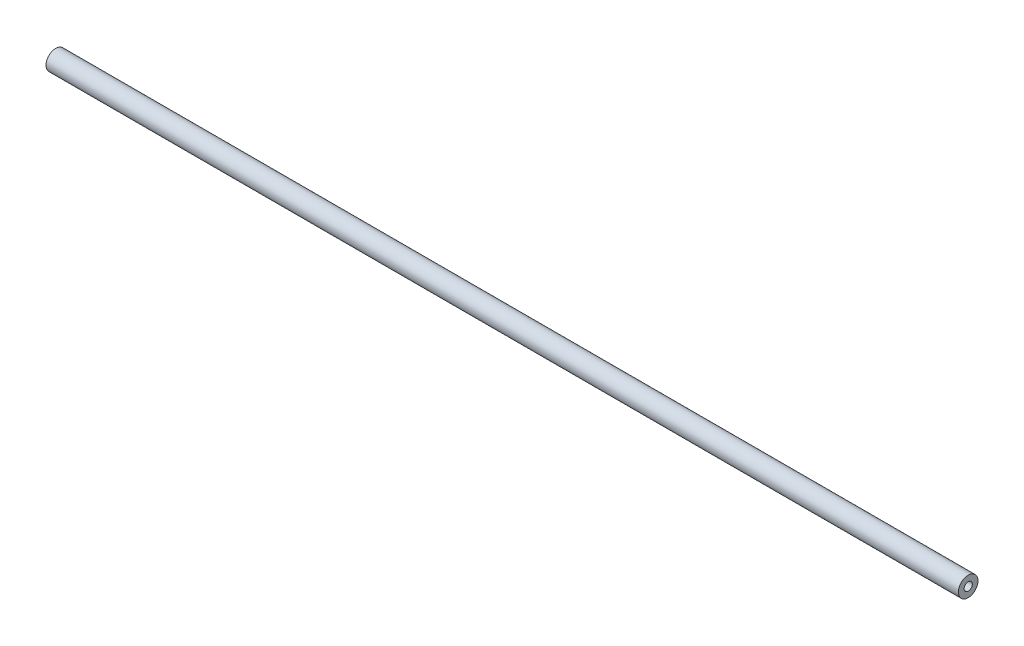
from build123d import *

# Parameters (mm, degrees)
SKETCH1_R           = 4.7625
SKETCH1_R_2         = 1.9939
BOSS_EXTRUDE1_DEPTH = 222.25


with BuildPart() as part:
    # Sketch1 → Boss-Extrude1 (new, symmetric)
    with BuildSketch(Plane(origin=(0, 0, 0), x_dir=(0, 0, -1), z_dir=(1, 0, 0))):
        Circle(SKETCH1_R)
        Circle(SKETCH1_R_2, mode=Mode.SUBTRACT)
    extrude(amount=BOSS_EXTRUDE1_DEPTH, both=True)


solid = part.part
